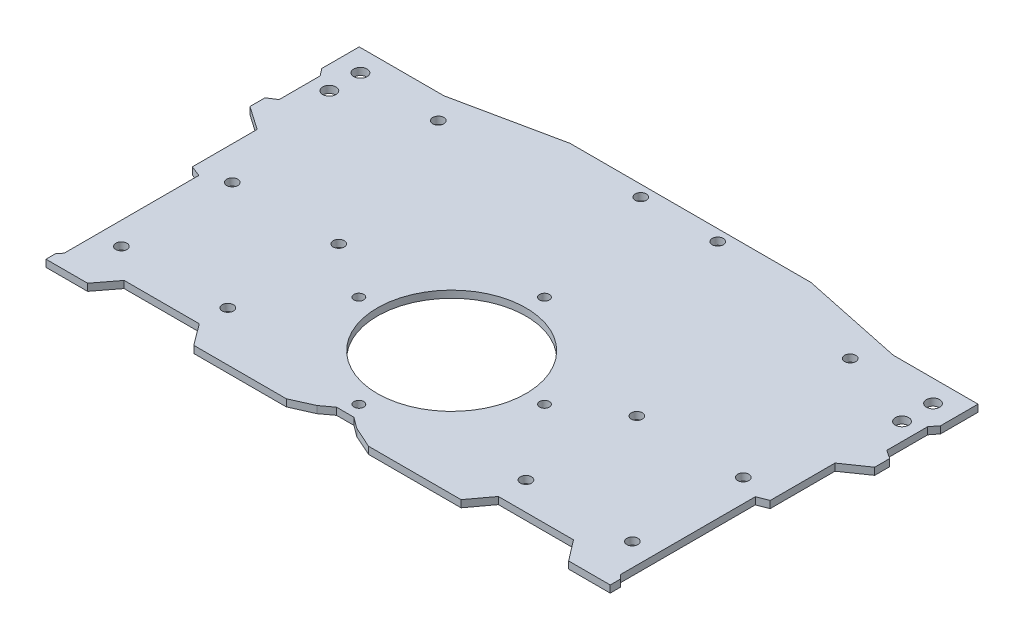
from build123d import *

# Parameters (mm, degrees)
CROQUIS1_R              = 1.25
CROQUIS1_R_2            = 1.5
CROQUIS1_R_3            = 16.75
CROQUIS1_R_4            = 1.1
SALIENTE_EXTRUIR1_DEPTH = 1.6


with BuildPart() as part:
    # Croquis1 → Saliente-Extruir1 (new body)
    with BuildSketch(Plane(origin=(0, 0, 0), x_dir=(1, 0, 0), z_dir=(0, 1, 0))):
        Polygon((65.571001722, 3.859007926), (61.644001722, 3.859007926), (59.104001722, 1.975007926), (54.333001722, -0.155992074), (33.470001722, -0.155992074), (29.893001722, 4.670007926), (12.949494381, 4.670007926), (9.375001722, 7.926e-06), (1.722e-06, 7.926e-06), (1.722e-06, 2.277007926), (0.872001722, 3.207007926), (0.872001722, 21.491007926), (0.872001722, 33.587260304), (-1.536998278, 34.539963538), (-1.536998278, 49.146007926), (-6.824998278, 52.811007926), (-6.824998278, 56.199007926), (-4.886998278, 57.460007926), (-4.886998278, 66.704007926), (-6.153998278, 68.325007926), (-6.153998278, 76.772007926), (-2.987377359, 76.772007926), (12.949494381, 76.772007926), (36.470001722, 81.705007926), (90.745001722, 81.705007926), (114.265509063, 76.772007926), (130.202380802, 76.772007926), (133.369001722, 76.772007926), (133.369001722, 68.325007926), (132.102001722, 66.704007926), (132.102001722, 57.460007926), (134.040001722, 56.199007926), (134.040001722, 52.811007926), (128.752001722, 49.146007926), (128.752001722, 34.539963538), (126.343001722, 33.587260304), (126.343001722, 21.491007926), (126.343001722, 3.207007926), (127.215001722, 2.277007926), (127.215001722, 7.926e-06), (117.840001722, 7.926e-06), (114.265509063, 4.670007926), (97.322001722, 4.670007926), (93.745001722, -0.155992074), (72.882001722, -0.155992074), (68.111001722, 1.975007926), align=None)
        with Locations(Location((5.998001722, 11.001007926, 0), (0, 0, 270))):
            Circle(CROQUIS1_R, mode=Mode.SUBTRACT)
        with Locations(Location((5.998001722, 36.001007926, 0), (0, 0, 270))):
            Circle(CROQUIS1_R, mode=Mode.SUBTRACT)
        with Locations(Location((121.217001722, 36.001007926, 0), (0, 0, 270))):
            Circle(CROQUIS1_R, mode=Mode.SUBTRACT)
        with Locations(Location((121.217001722, 11.001007926, 0), (0, 0, 270))):
            Circle(CROQUIS1_R, mode=Mode.SUBTRACT)
        with Locations(Location((-0.950998278, 71.841007926, 0), (0, 0, 270))):
            Circle(CROQUIS1_R_2, mode=Mode.SUBTRACT)
        with Locations(Location((-0.950998278, 64.841007926, 0), (0, 0, 270))):
            Circle(CROQUIS1_R_2, mode=Mode.SUBTRACT)
        with Locations(Location((17.167001722, 71.285007926, 0), (0, 0, 270))):
            Circle(CROQUIS1_R, mode=Mode.SUBTRACT)
        with Locations(Location((54.929001722, 79.176007926, 0), (0, 0, 270))):
            Circle(CROQUIS1_R, mode=Mode.SUBTRACT)
        with Locations(Location((29.998001722, 36.001007926, 0), (0, 0, 270))):
            Circle(CROQUIS1_R, mode=Mode.SUBTRACT)
        with Locations(Location((29.998001722, 11.001007926, 0), (0, 0, 270))):
            Circle(CROQUIS1_R, mode=Mode.SUBTRACT)
        with Locations(Location((97.217001722, 11.001007926, 0), (0, 0, 270))):
            Circle(CROQUIS1_R, mode=Mode.SUBTRACT)
        with Locations(Location((97.217001722, 36.001007926, 0), (0, 0, 270))):
            Circle(CROQUIS1_R, mode=Mode.SUBTRACT)
        with Locations(Location((72.286001722, 79.176007926, 0), (0, 0, 270))):
            Circle(CROQUIS1_R, mode=Mode.SUBTRACT)
        with Locations(Location((110.048001722, 71.285007926, 0), (0, 0, 270))):
            Circle(CROQUIS1_R, mode=Mode.SUBTRACT)
        with Locations(Location((128.166001722, 64.841007926, 0), (0, 0, 270))):
            Circle(CROQUIS1_R_2, mode=Mode.SUBTRACT)
        with Locations(Location((128.166001722, 71.841007926, 0), (0, 0, 270))):
            Circle(CROQUIS1_R_2, mode=Mode.SUBTRACT)
        with Locations(Location((63.607501722, 27.859007926, 0), (0, 0, 270))):
            Circle(CROQUIS1_R_3, mode=Mode.SUBTRACT)
        with Locations(Location((63.607501722, 48.779312854, 0), (0, 0, 270))):
            Circle(CROQUIS1_R_4, mode=Mode.SUBTRACT)
        with Locations(Location((84.52780665, 27.859007926, 0), (0, 0, 270))):
            Circle(CROQUIS1_R_4, mode=Mode.SUBTRACT)
        with Locations(Location((63.607501722, 6.938702998, 0), (0, 0, 270))):
            Circle(CROQUIS1_R_4, mode=Mode.SUBTRACT)
        with Locations(Location((42.687196794, 27.859007926, 0), (0, 0, 270))):
            Circle(CROQUIS1_R_4, mode=Mode.SUBTRACT)
    extrude(amount=SALIENTE_EXTRUIR1_DEPTH)


solid = part.part
